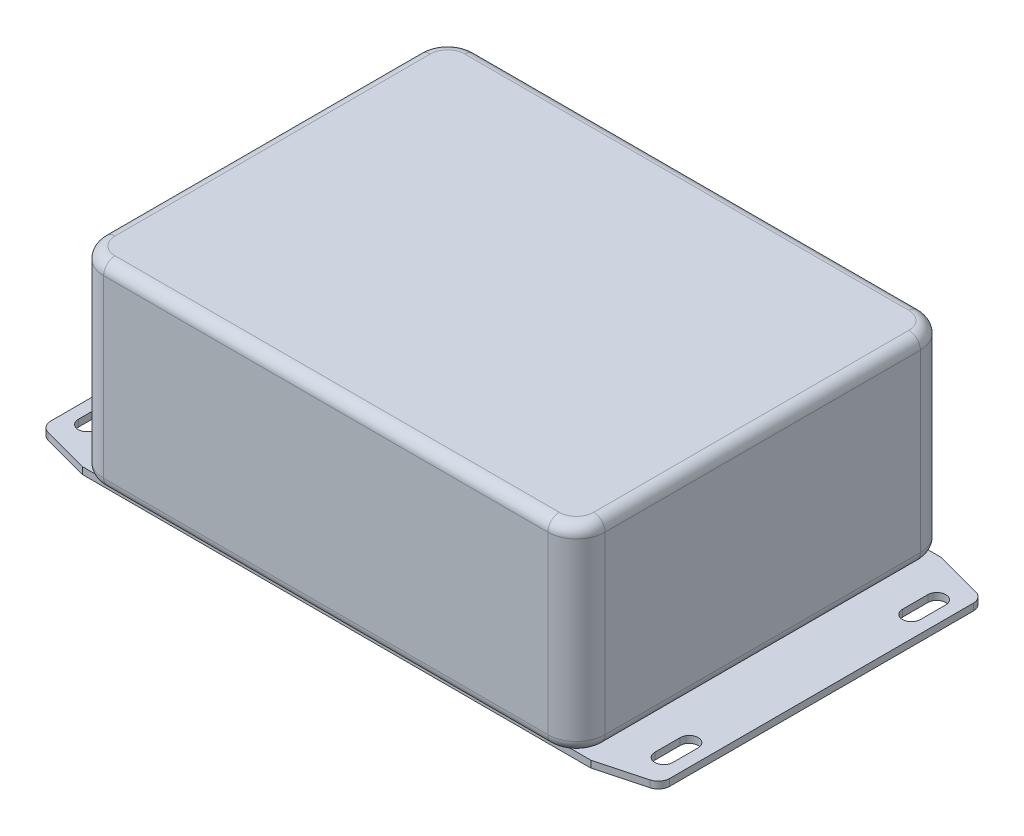
from build123d import *

# Parameters (mm, degrees)
BOSS_EXTRUDE1_DEPTH = 1.524
BOSS_EXTRUDE2_DEPTH = 43.942
FILLET1_R           = 2.54


with BuildPart() as part:
    # Sketch1 → Boss-Extrude1 (new body)
    with BuildSketch(Plane(origin=(0, 0, 0), x_dir=(1, 0, 0), z_dir=(0, 1, 0))):
        with BuildLine():
            Line((-68.58, 33.629138123), (-68.58, -33.629138123))
            ThreePointArc((-68.58, -33.629138123), (-68.055117484, -35.175392152), (-66.697400375, -36.082589721))
            Line((-66.697400375, -36.082589721), (-56.3245, -38.862))
            Line((-56.3245, -38.862), (0, -38.862))
            Line((0, -38.862), (56.3245, -38.862))
            Line((56.3245, -38.862), (66.697400375, -36.082589721))
            ThreePointArc((66.697400375, -36.082589721), (68.055117484, -35.175392152), (68.58, -33.629138123))
            Line((68.58, -33.629138123), (68.58, 33.629138123))
            ThreePointArc((68.58, 33.629138123), (68.055117484, 35.175392152), (66.697400375, 36.082589721))
            Line((66.697400375, 36.082589721), (56.3245, 38.862))
            Line((56.3245, 38.862), (0, 38.862))
            Line((0, 38.862), (-56.3245, 38.862))
            Line((-56.3245, 38.862), (-66.697400375, 36.082589721))
            ThreePointArc((-66.697400375, 36.082589721), (-68.055117484, 35.175392152), (-68.58, 33.629138123))
        make_face()
        with BuildLine():
            Line((-65.8622, 24.6253), (-65.8622, 30.2387))
            ThreePointArc((-65.8622, 30.2387), (-63.881, 32.2199), (-61.8998, 30.2387))
            Line((-61.8998, 30.2387), (-61.8998, 24.6253))
            ThreePointArc((-61.8998, 24.6253), (-63.881, 22.6441), (-65.8622, 24.6253))
        make_face(mode=Mode.SUBTRACT)
        with BuildLine():
            Line((61.8998, 24.6253), (61.8998, 30.2387))
            ThreePointArc((61.8998, 30.2387), (63.881, 32.2199), (65.8622, 30.2387))
            Line((65.8622, 30.2387), (65.8622, 24.6253))
            ThreePointArc((65.8622, 24.6253), (63.881, 22.6441), (61.8998, 24.6253))
        make_face(mode=Mode.SUBTRACT)
        with BuildLine():
            Line((61.8998, -30.2387), (61.8998, -24.6253))
            ThreePointArc((61.8998, -24.6253), (63.881, -22.6441), (65.8622, -24.6253))
            Line((65.8622, -24.6253), (65.8622, -30.2387))
            ThreePointArc((65.8622, -30.2387), (63.881, -32.2199), (61.8998, -30.2387))
        make_face(mode=Mode.SUBTRACT)
        with BuildLine():
            Line((-65.8622, -30.2387), (-65.8622, -24.6253))
            ThreePointArc((-65.8622, -24.6253), (-63.881, -22.6441), (-61.8998, -24.6253))
            Line((-61.8998, -24.6253), (-61.8998, -30.2387))
            ThreePointArc((-61.8998, -30.2387), (-63.881, -32.2199), (-65.8622, -30.2387))
        make_face(mode=Mode.SUBTRACT)
    extrude(amount=BOSS_EXTRUDE1_DEPTH)


with BuildPart() as body_2:
    # Sketch2 → Boss-Extrude2 (new body)
    with BuildSketch(Plane(origin=(0, 1.524, 0), x_dir=(1, 0, 0), z_dir=(0, 1, 0))):
        with BuildLine():
            Line((55.5625, -34.925), (55.5625, 34.925))
            ThreePointArc((55.5625, 34.925), (53.702628061, 39.415128061), (49.2125, 41.275))
            Line((49.2125, 41.275), (-49.2125, 41.275))
            ThreePointArc((-49.2125, 41.275), (-53.702628061, 39.415128061), (-55.5625, 34.925))
            Line((-55.5625, 34.925), (-55.5625, -34.925))
            ThreePointArc((-55.5625, -34.925), (-53.702628061, -39.415128061), (-49.2125, -41.275))
            Line((-49.2125, -41.275), (49.2125, -41.275))
            ThreePointArc((49.2125, -41.275), (53.702628061, -39.415128061), (55.5625, -34.925))
        make_face()
    extrude(amount=BOSS_EXTRUDE2_DEPTH)

    # Fillet1
    fillet1_edges = [body_2.edges().sort_by_distance(p)[0] for p in [
        (-55.5625, 1.524, 0),
        (-53.702628061, 1.524, -39.415128061),
        (0, 1.524, -41.275),
        (53.702628061, 1.524, -39.415128061),
        (55.5625, 45.466, 0),
        (53.702628061, 45.466, 39.415128061),
        (0, 45.466, 41.275),
        (-53.702628061, 45.466, 39.415128061),
        (-55.5625, 45.466, 0),
        (-53.702628061, 45.466, -39.415128061),
        (0, 45.466, -41.275),
        (53.702628061, 45.466, -39.415128061),
        (55.5625, 1.524, 0),
        (53.702628061, 1.524, 39.415128061),
        (0, 1.524, 41.275),
        (-53.702628061, 1.524, 39.415128061),
    ]]
    fillet(fillet1_edges, radius=FILLET1_R)

    # Combine1: union part
    add(part.part)


solid = body_2.part
